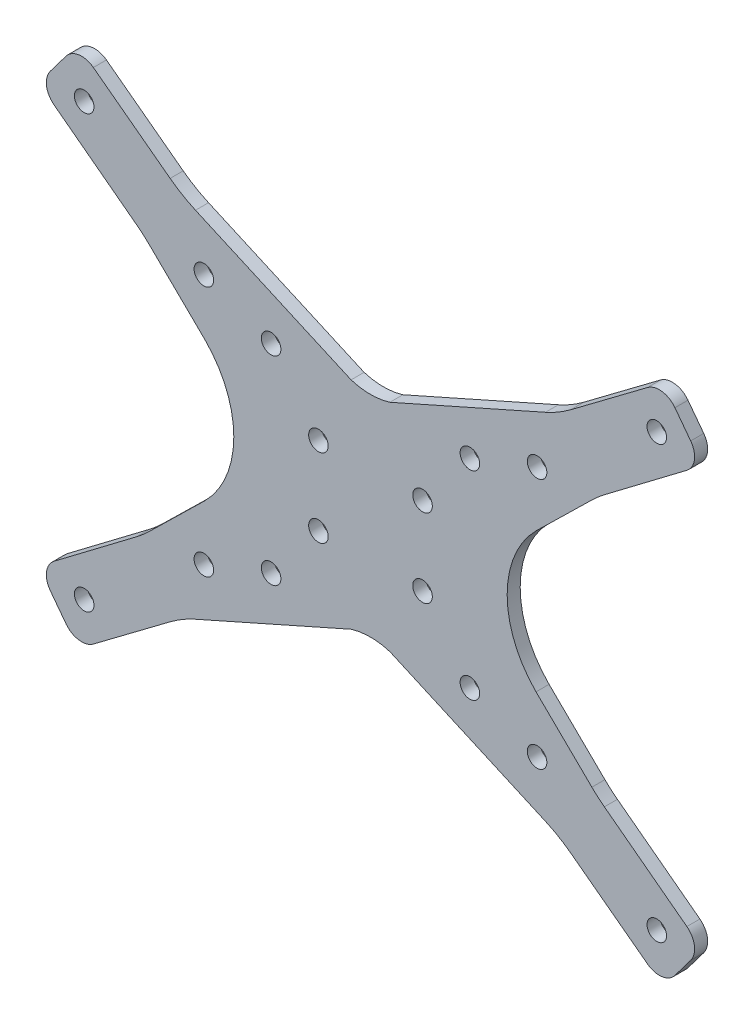
from build123d import *

# Parameters (mm, degrees)
CROQUIS1_R              = 1.5
SALIENTE_EXTRUIR1_DEPTH = 2


with BuildPart() as part:
    # Croquis1 → Saliente-Extruir1 (new body)
    with BuildSketch(Plane.XY):
        with BuildLine():
            Line((-806.293781222, 387.093592203), (-805.087201617, 388.694777419))
            ThreePointArc((-805.087201617, 388.694777419), (-803.111242937, 389.859794234), (-800.889769824, 389.288187645))
            Line((-800.889769824, 389.288187645), (-789.110634699, 380.442131133))
            ThreePointArc((-789.110634699, 380.442131133), (-787.230269134, 379.189584745), (-785.220630898, 378.157111371))
            Line((-785.220630898, 378.157111371), (-761.350873045, 367.552403578))
            ThreePointArc((-761.350873045, 367.552403578), (-758.375650619, 367.099552447), (-755.400428194, 367.552403578))
            Line((-755.400428194, 367.552403578), (-731.530670341, 378.157111371))
            ThreePointArc((-731.530670341, 378.157111371), (-729.521032104, 379.189584745), (-727.640666539, 380.442131133))
            Line((-727.640666539, 380.442131133), (-715.861531414, 389.288187645))
            ThreePointArc((-715.861531414, 389.288187645), (-713.640058301, 389.859794234), (-711.664099621, 388.694777419))
            Line((-711.664099621, 388.694777419), (-710.457520016, 387.093592203))
            Line((-710.457520016, 387.093592203), (-709.250181935, 385.491400454))
            ThreePointArc((-709.250181935, 385.491400454), (-708.674856636, 383.271490166), (-709.835721429, 381.293765761))
            Line((-709.835721429, 381.293765761), (-722.491711895, 371.715934755))
            ThreePointArc((-722.491711895, 371.715934755), (-723.477203121, 370.919812191), (-724.410312611, 370.062892842))
            Line((-724.410312611, 370.062892842), (-732.976662667, 361.68062014))
            ThreePointArc((-732.976662667, 361.68062014), (-737.407061656, 350.984690814), (-732.976662667, 340.288761488))
            Line((-732.976662667, 340.288761488), (-724.410312611, 331.906488787))
            ThreePointArc((-724.410312611, 331.906488787), (-723.477203121, 331.049569437), (-722.491711895, 330.253446873))
            Line((-722.491711895, 330.253446873), (-709.835721429, 320.675615867))
            ThreePointArc((-709.835721429, 320.675615867), (-708.674856636, 318.697891463), (-709.250181935, 316.477981174))
            Line((-709.250181935, 316.477981174), (-710.457520016, 314.875789425))
            Line((-710.457520016, 314.875789425), (-711.664099621, 313.274604209))
            ThreePointArc((-711.664099621, 313.274604209), (-713.640058301, 312.109587395), (-715.861531414, 312.681193984))
            Line((-715.861531414, 312.681193984), (-727.640666539, 321.527250495))
            ThreePointArc((-727.640666539, 321.527250495), (-729.521032104, 322.779796883), (-731.530670341, 323.812270257))
            Line((-731.530670341, 323.812270257), (-755.400428194, 334.41697805))
            ThreePointArc((-755.400428194, 334.41697805), (-758.375650619, 334.869829182), (-761.350873045, 334.41697805))
            Line((-761.350873045, 334.41697805), (-785.220630898, 323.812270257))
            ThreePointArc((-785.220630898, 323.812270257), (-787.230269134, 322.779796883), (-789.110634699, 321.527250495))
            Line((-789.110634699, 321.527250495), (-800.889769824, 312.681193984))
            ThreePointArc((-800.889769824, 312.681193984), (-803.111242937, 312.109587395), (-805.087201617, 313.274604209))
            Line((-805.087201617, 313.274604209), (-806.293781222, 314.875789425))
            Line((-806.293781222, 314.875789425), (-807.501119304, 316.477981174))
            ThreePointArc((-807.501119304, 316.477981174), (-808.076444603, 318.697891463), (-806.915579809, 320.675615867))
            Line((-806.915579809, 320.675615867), (-794.259589343, 330.253446873))
            ThreePointArc((-794.259589343, 330.253446873), (-793.274098117, 331.049569437), (-792.340988627, 331.906488787))
            Line((-792.340988627, 331.906488787), (-783.774638572, 340.288761488))
            ThreePointArc((-783.774638572, 340.288761488), (-779.344239583, 350.984690814), (-783.774638572, 361.68062014))
            Line((-783.774638572, 361.68062014), (-792.340988627, 370.062892842))
            ThreePointArc((-792.340988627, 370.062892842), (-793.274098117, 370.919812191), (-794.259589343, 371.715934755))
            Line((-794.259589343, 371.715934755), (-806.915579809, 381.293765761))
            ThreePointArc((-806.915579809, 381.293765761), (-808.076444603, 383.271490166), (-807.501119304, 385.491400454))
            Line((-807.501119304, 385.491400454), (-806.293781222, 387.093592203))
        make_face()
        with Locations((-802.300603672, 384.084517088)):
            Circle(CROQUIS1_R, mode=Mode.SUBTRACT)
        with Locations((-783.935934024, 370.245745896)):
            Circle(CROQUIS1_R, mode=Mode.SUBTRACT)
        with Locations((-766.36200572, 357.002841046)):
            Circle(CROQUIS1_R, mode=Mode.SUBTRACT)
        with Locations((-773.625650619, 366.234690814)):
            Circle(CROQUIS1_R, mode=Mode.SUBTRACT)
        with Locations(Location((-750.389295519, 357.002841046, 0), (0, 0, 180))):
            Circle(CROQUIS1_R, mode=Mode.SUBTRACT)
        with Locations(Location((-743.125650619, 366.234690814, 0), (0, 0, 180))):
            Circle(CROQUIS1_R, mode=Mode.SUBTRACT)
        with Locations(Location((-732.815367214, 370.245745896, 0), (0, 0, 180))):
            Circle(CROQUIS1_R, mode=Mode.SUBTRACT)
        with Locations(Location((-714.450697566, 384.084517088, 0), (0, 0, 180))):
            Circle(CROQUIS1_R, mode=Mode.SUBTRACT)
        with Locations((-714.450697566, 317.884864541)):
            Circle(CROQUIS1_R, mode=Mode.SUBTRACT)
        with Locations((-732.815367214, 331.723635733)):
            Circle(CROQUIS1_R, mode=Mode.SUBTRACT)
        with Locations((-743.125650619, 335.734690814)):
            Circle(CROQUIS1_R, mode=Mode.SUBTRACT)
        with Locations((-750.389295519, 344.966540583)):
            Circle(CROQUIS1_R, mode=Mode.SUBTRACT)
        with Locations(Location((-766.36200572, 344.966540583, 0), (0, 0, 180))):
            Circle(CROQUIS1_R, mode=Mode.SUBTRACT)
        with Locations(Location((-773.625650619, 335.734690814, 0), (0, 0, 180))):
            Circle(CROQUIS1_R, mode=Mode.SUBTRACT)
        with Locations(Location((-783.935934024, 331.723635733, 0), (0, 0, 180))):
            Circle(CROQUIS1_R, mode=Mode.SUBTRACT)
        with Locations(Location((-802.300603672, 317.884864541, 0), (0, 0, 180))):
            Circle(CROQUIS1_R, mode=Mode.SUBTRACT)
    extrude(amount=SALIENTE_EXTRUIR1_DEPTH)


solid = part.part
